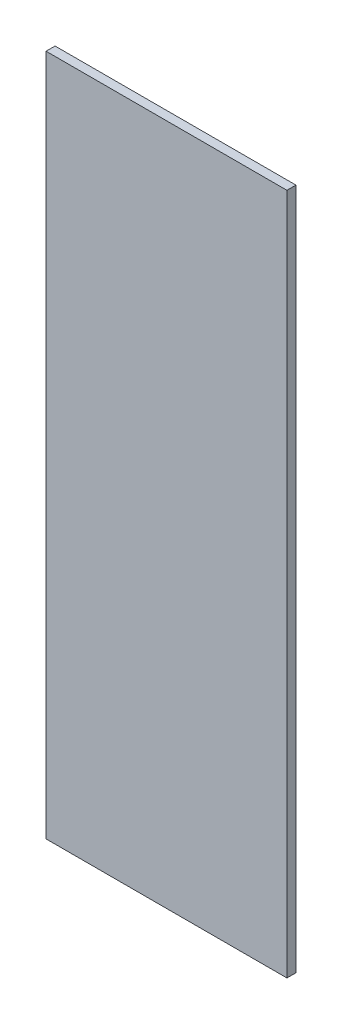
from build123d import *

# Parameters (mm, degrees)
ESQUISSE1_W        = 107
ESQUISSE1_H        = 303
BOSS_EXTRU_1_DEPTH = 4


with BuildPart() as part:
    # Esquisse1 → Boss.-Extru.1 (new body)
    with BuildSketch(Plane.XY):
        Rectangle(ESQUISSE1_W, ESQUISSE1_H)
    extrude(amount=BOSS_EXTRU_1_DEPTH)


solid = part.part
